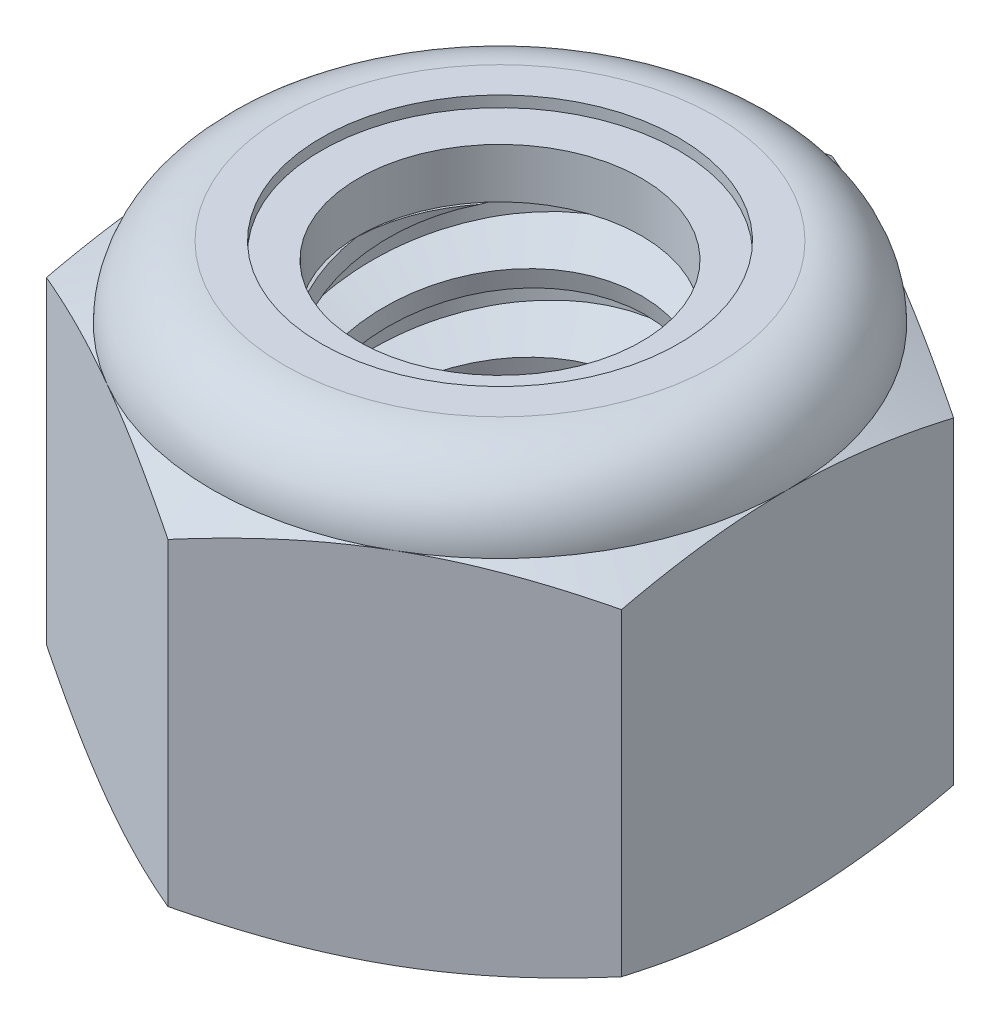
from build123d import *

# Parameters (mm, degrees)
EXTRUDE1_DEPTH      = 5.953125
SKETCH2_W           = 2.413
SKETCH2_H           = 5.953125
LPATTERN1_COUNT     = 6
LPATTERN1_PITCH     = 1.058333333
LPATTERN1_COL_COUNT = 2
LPATTERN1_COL_PITCH = 1.058333333


with BuildPart() as part:
    # Sketch1 → Extrude1 (new body)
    with BuildSketch(Plane(origin=(0, 0, 0), x_dir=(1, 0, 0), z_dir=(0, 1, 0))):
        Polygon((0, 4.582717762), (-3.96875, 2.291358881), (-3.96875, -2.291358881), (0, -4.582717762), (3.96875, -2.291358881), (3.96875, 2.291358881), align=None)
    extrude(amount=EXTRUDE1_DEPTH)

    # Sketch4 → Cut-Revolve2 (revolve, cut)
    with BuildSketch(Plane(origin=(0, 0, 0), x_dir=(0, 0, -1), z_dir=(1, 0, 0)), mode=Mode.PRIVATE) as cut_revolve2_sk:
        Polygon((0, 5.953125), (2.413, 5.953125), (1.952639712, 5.738455472), (1.952639712, 0.214669528), (2.413, 0), (0, 0), align=None)
    revolve(cut_revolve2_sk.sketch.rotate(Axis((0, 5.953125, 0), (0, 1, 0)), 47.786997384), axis=Axis((0, 5.953125, 0), (0, 1, 0)), mode=Mode.SUBTRACT)


with BuildPart() as body_2:
    # Sketch2 → Revolve1 (revolve)
    with BuildSketch(Plane(origin=(0, 0, 0), x_dir=(0, 0, -1), z_dir=(1, 0, 0))):
        with Locations((1.2065, 2.9765625)):
            Rectangle(SKETCH2_W, SKETCH2_H)
    revolve(axis=Axis((0, -2.413, 0), (0, 1, 0)))

    # Sketch3 → Cut-Revolve1 (revolve, cut)
    with BuildSketch(Plane(origin=(0, 0, 0), x_dir=(0, 0, -1), z_dir=(1, 0, 0)), mode=Mode.PRIVATE) as cut_revolve1_sk:
        Polygon((2.441337922, 5.823904076), (2.639703376, 4.919357607), (2.009315556, 5.119703115), (1.952639712, 5.378144964), align=None)
    cut_revolve1 = revolve(cut_revolve1_sk.sketch.rotate(Axis((0, 5.953125, 0.249698658), (0, -0.976788088344826, -0.2142079141107079)), 180), axis=Axis((0, 5.953125, 0.249698658), (0, -0.976788088344826, -0.2142079141107079)), mode=Mode.SUBTRACT)

    # LPattern1: Cut-Revolve1 ×6
    with Locations(*[(0, -i * LPATTERN1_PITCH, 0) for i in range(1, LPATTERN1_COUNT)]):
        add(cut_revolve1, mode=Mode.SUBTRACT)

    # LPattern1 col: Cut-Revolve1 ×2
    with Locations(*[(0, i * LPATTERN1_COL_PITCH, 0) for i in range(1, LPATTERN1_COL_COUNT)]):
        add(cut_revolve1, mode=Mode.SUBTRACT)


with BuildPart() as part_1:
    add(part.part)

    # Combine1: cut body 2
    add(body_2.part, mode=Mode.SUBTRACT)

    # Sketch5 → Cut-Revolve3 (revolve, cut)
    with BuildSketch(Plane(origin=(0, 0, 0), x_dir=(0, 0, -1), z_dir=(1, 0, 0)), mode=Mode.PRIVATE) as cut_revolve3_sk:
        with BuildLine():
            Line((0, 0), (3.96875, 0))
            Line((3.96875, 0), (4.582717762, 0.286297869))
            Line((4.582717762, 0.286297869), (4.582717762, 4.674639631))
            Line((4.582717762, 4.674639631), (3.96875, 4.9609375))
            ThreePointArc((3.96875, 4.9609375), (3.678145009, 5.662520009), (2.9765625, 5.953125))
            Line((2.9765625, 5.953125), (2.9765625, 7.223125))
            Line((2.9765625, 7.223125), (5.852717762, 7.223125))
            Line((5.852717762, 7.223125), (5.852717762, -1.27))
            Line((5.852717762, -1.27), (0, -1.27))
            Line((0, -1.27), (0, 0))
        make_face()
    revolve(cut_revolve3_sk.sketch.rotate(Axis((0, 0, 0), (0, 1, 0)), 47.786997384), axis=Axis((0, 0, 0), (0, 1, 0)), mode=Mode.SUBTRACT)

    # Sketch6 → Cut-Revolve4 (revolve, cut)
    with BuildSketch(Plane(origin=(0, 0, 0), x_dir=(0, 0, -1), z_dir=(1, 0, 0)), mode=Mode.PRIVATE) as cut_revolve4_sk:
        with BuildLine():
            Line((0, 4.9609375), (3.81635, 4.9609375))
            ThreePointArc((3.81635, 4.9609375), (3.570381936, 5.554756936), (2.9765625, 5.800725))
            Line((2.9765625, 5.800725), (2.464601106, 5.800725))
            Line((2.464601106, 5.800725), (2.464601106, 7.223125))
            Line((2.464601106, 7.223125), (0, 7.223125))
            Line((0, 7.223125), (0, 4.9609375))
        make_face()
    revolve(cut_revolve4_sk.sketch.rotate(Axis((0, 7.223125, 0), (0, 1, 0)), 19.898434891), axis=Axis((0, 7.223125, 0), (0, 1, 0)), mode=Mode.SUBTRACT)


with BuildPart() as body_2_2:
    # Sketch7 → Revolve2 (revolve)
    with BuildSketch(Plane(origin=(0, 0, 0), x_dir=(0, 0, -1), z_dir=(1, 0, 0))):
        with BuildLine():
            Line((1.952639712, 5.0371375), (3.736338408, 5.0371375))
            ThreePointArc((3.736338408, 5.0371375), (3.488851726, 5.527175629), (2.9765625, 5.724525))
            Line((2.9765625, 5.724525), (1.952639712, 5.724525))
            Line((1.952639712, 5.724525), (1.952639712, 5.0371375))
        make_face()
    revolve(axis=Axis((0, 5.0371375, 0), (0, 1, 0)))


solid = Compound([part_1.part, body_2_2.part])
